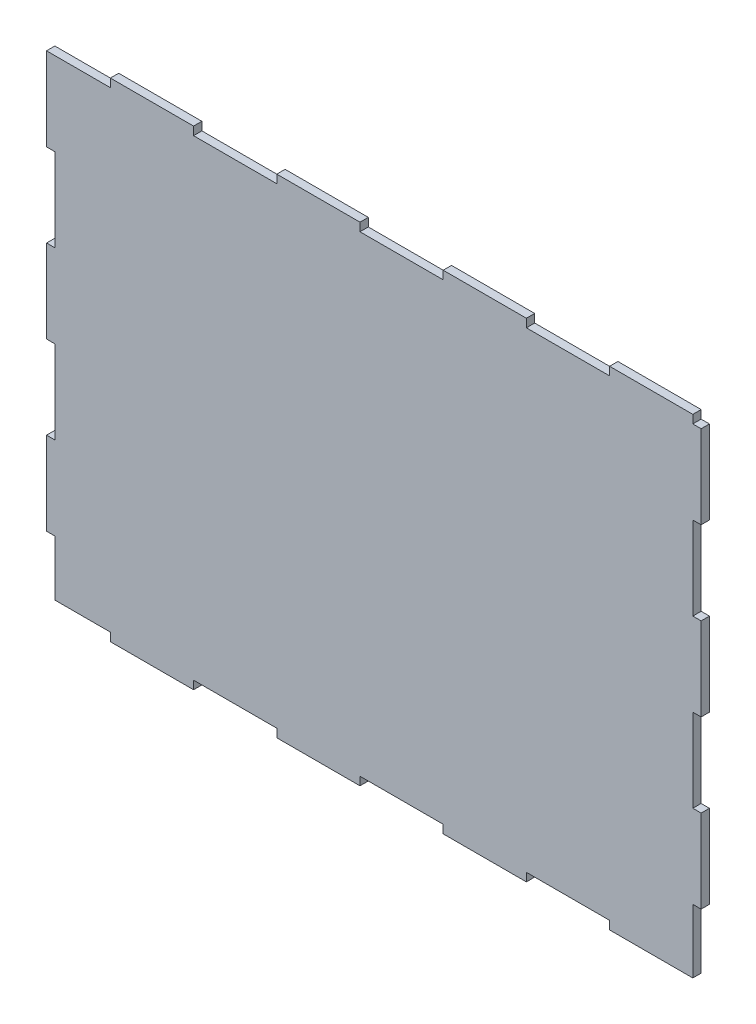
from build123d import *

# Parameters (mm, degrees)
ESQUISSE1_W        = 230
ESQUISSE1_H        = 170
BOSS_EXTRU_1_DEPTH = 3
ESQUISSE2_W        = 30
ESQUISSE2_H        = 3
BOSS_EXTRU_6_DEPTH = 3
ESQUISSE4_W        = 3
ESQUISSE4_H        = 30
BOSS_EXTRU_7_DEPTH = 3


with BuildPart() as part:
    # Esquisse1 → Boss.-Extru.1 (new body)
    with BuildSketch(Plane.XY):
        with Locations((29.537157757, -23.076923077)):
            Rectangle(ESQUISSE1_W, ESQUISSE1_H)
    extrude(amount=BOSS_EXTRU_1_DEPTH)

    # Esquisse2 → Boss.-Extru.6 (add)
    with BuildSketch(Plane(origin=(0, 0, 0), x_dir=(-1, 0, 0), z_dir=(0, 0, -1))):
        with Locations((-129.537157757, 63.423076923)):
            Rectangle(ESQUISSE2_W, ESQUISSE2_H)
        with Locations((-69.537157757, 63.423076923)):
            Rectangle(ESQUISSE2_W, ESQUISSE2_H)
        with Locations((-9.537157757, 63.423076923)):
            Rectangle(ESQUISSE2_W, ESQUISSE2_H)
        with Locations((50.462842243, 63.423076923)):
            Rectangle(ESQUISSE2_W, ESQUISSE2_H)
        with Locations((50.462842243, -109.576923077)):
            Rectangle(ESQUISSE2_W, ESQUISSE2_H)
        with Locations((-129.537157757, -109.576923077)):
            Rectangle(ESQUISSE2_W, ESQUISSE2_H)
        with Locations((-69.537157757, -109.576923077)):
            Rectangle(ESQUISSE2_W, ESQUISSE2_H)
        with Locations((-9.537157757, -109.576923077)):
            Rectangle(ESQUISSE2_W, ESQUISSE2_H)
    extrude(amount=-BOSS_EXTRU_6_DEPTH)

    # Esquisse4 → Boss.-Extru.7 (add)
    with BuildSketch(Plane(origin=(0, 0, 0), x_dir=(-1, 0, 0), z_dir=(0, 0, -1))):
        with Locations((86.962842243, 46.923076923)):
            Rectangle(ESQUISSE4_W, ESQUISSE4_H)
        with Locations((86.962842243, -13.076923077)):
            Rectangle(ESQUISSE4_W, ESQUISSE4_H)
        with Locations((86.962842243, -73.076923077)):
            Rectangle(ESQUISSE4_W, ESQUISSE4_H)
        with Locations((-146.037157757, 46.923076923)):
            Rectangle(ESQUISSE4_W, ESQUISSE4_H)
        with Locations((-146.037157757, -13.076923077)):
            Rectangle(ESQUISSE4_W, ESQUISSE4_H)
        with Locations((-146.037157757, -73.076923077)):
            Rectangle(ESQUISSE4_W, ESQUISSE4_H)
    extrude(amount=-BOSS_EXTRU_7_DEPTH)


solid = part.part
